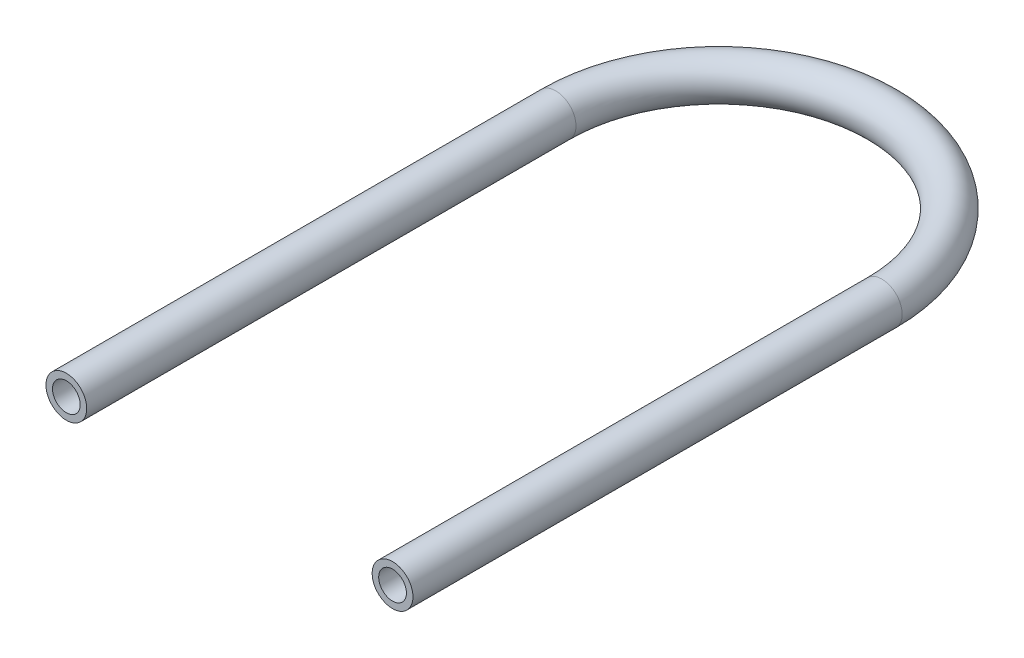
from build123d import *

# Parameters (mm, degrees)
SKETCH4_R   = 3.175
SKETCH4_R_2 = 2.159


with BuildPart() as part:
    # Sweep1: sweep along a path in Sketch3
    with BuildLine(Plane(origin=(0, 0, 0), x_dir=(1, 0, 0), z_dir=(0, 1, 0))) as sweep1_path:
        Line((-25.4, 0), (-25.4, 76.2))
        ThreePointArc((-25.4, 76.2), (0, 101.6), (25.4, 76.2))
        Line((25.4, 76.2), (25.4, 0))
    # Sketch4 → Sweep1 (sweep)
    with BuildSketch(Plane.XY):
        with Locations((-25.4, 0)):
            Circle(SKETCH4_R)
        with Locations((-25.4, 0)):
            Circle(SKETCH4_R_2, mode=Mode.SUBTRACT)
    sweep(path=sweep1_path.line)


solid = part.part
